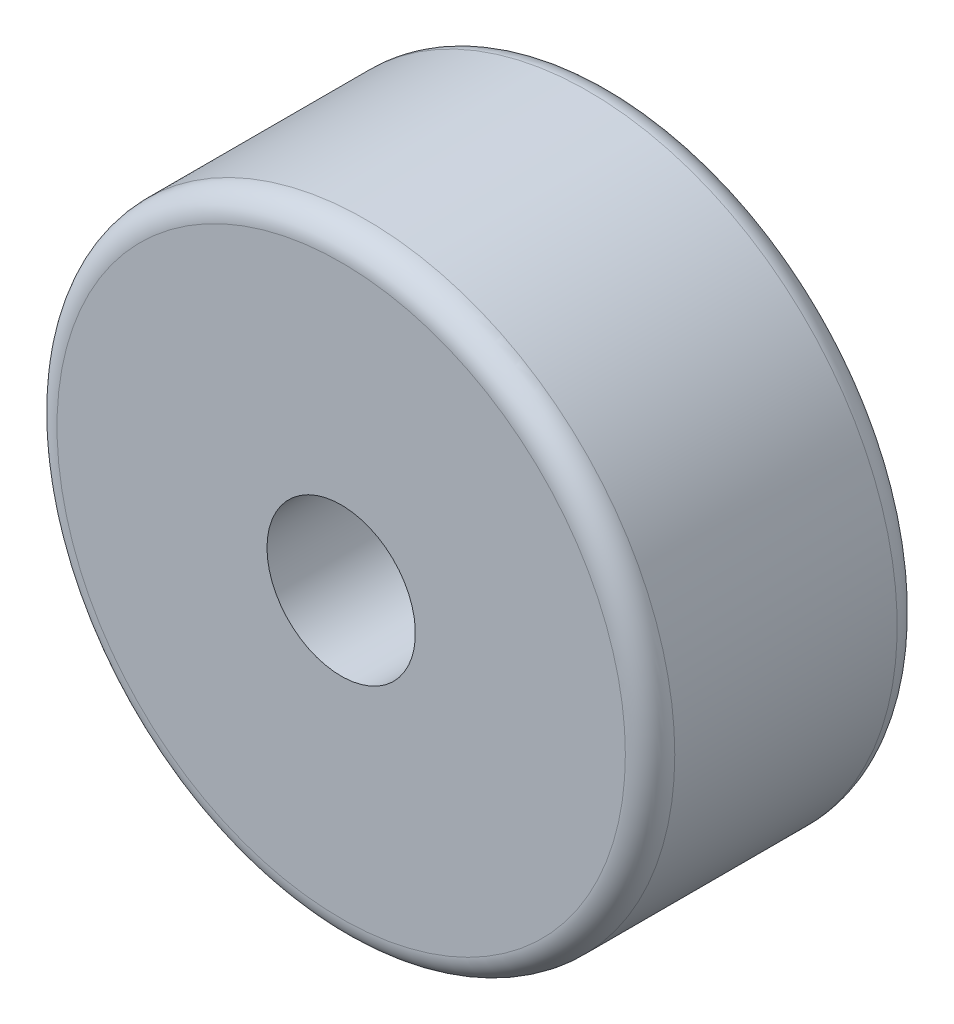
from build123d import *

# Parameters (mm, degrees)
SKETCH1_W = 55.88
SKETCH1_H = 48.2473
FILLET1_R = 5.08


with BuildPart() as part:
    # Sketch1 → Revolve1 (revolve)
    with BuildSketch(Plane(origin=(0, 0, 0), x_dir=(0, 0, -1), z_dir=(1, 0, 0)), mode=Mode.PRIVATE) as revolve1_sk:
        with Locations((0, 39.37635)):
            Rectangle(SKETCH1_W, SKETCH1_H)
    revolve(revolve1_sk.sketch.rotate(Axis((0, 0, 0), (0, 0, 1)), 90), axis=Axis((0, 0, 0), (0, 0, 1)))

    # Fillet1
    fillet1_edges = [part.edges().sort_by_distance(p)[0] for p in [
        (63.5, 0, -27.94),
        (63.5, 0, 27.94),
    ]]
    fillet(fillet1_edges, radius=FILLET1_R)


solid = part.part
